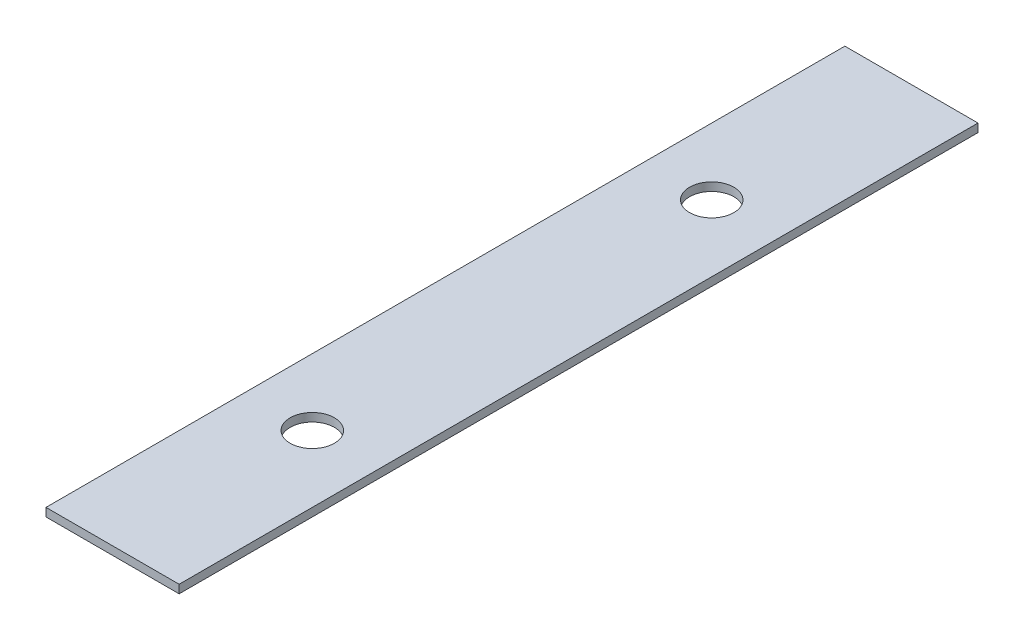
from build123d import *

# Parameters (mm, degrees)
SKETCH1_W                   = 25.4
SKETCH1_H                   = 152.4
BOSS_EXTRUDE1_DEPTH         = 1.5875
TAP_DRILL_FOR_3_8_24_TAP1_D = 8.4328


with BuildPart() as part:
    # Sketch1 → Boss-Extrude1 (new body)
    with BuildSketch(Plane(origin=(0, 0, 0), x_dir=(1, 0, 0), z_dir=(0, 1, 0))):
        with Locations((12.7, 76.2)):
            Rectangle(SKETCH1_W, SKETCH1_H)
    extrude(amount=BOSS_EXTRUDE1_DEPTH)

    # Tap Drill for 3/8-24 Tap1 (through all)
    with Locations(Plane(origin=(0, 1.5875, 0), x_dir=(1, 0, 0), z_dir=(0, 1, 0))):
        with Locations((12.7, 114.3), (12.7, 38.1)):
            Hole(TAP_DRILL_FOR_3_8_24_TAP1_D / 2)


solid = part.part
